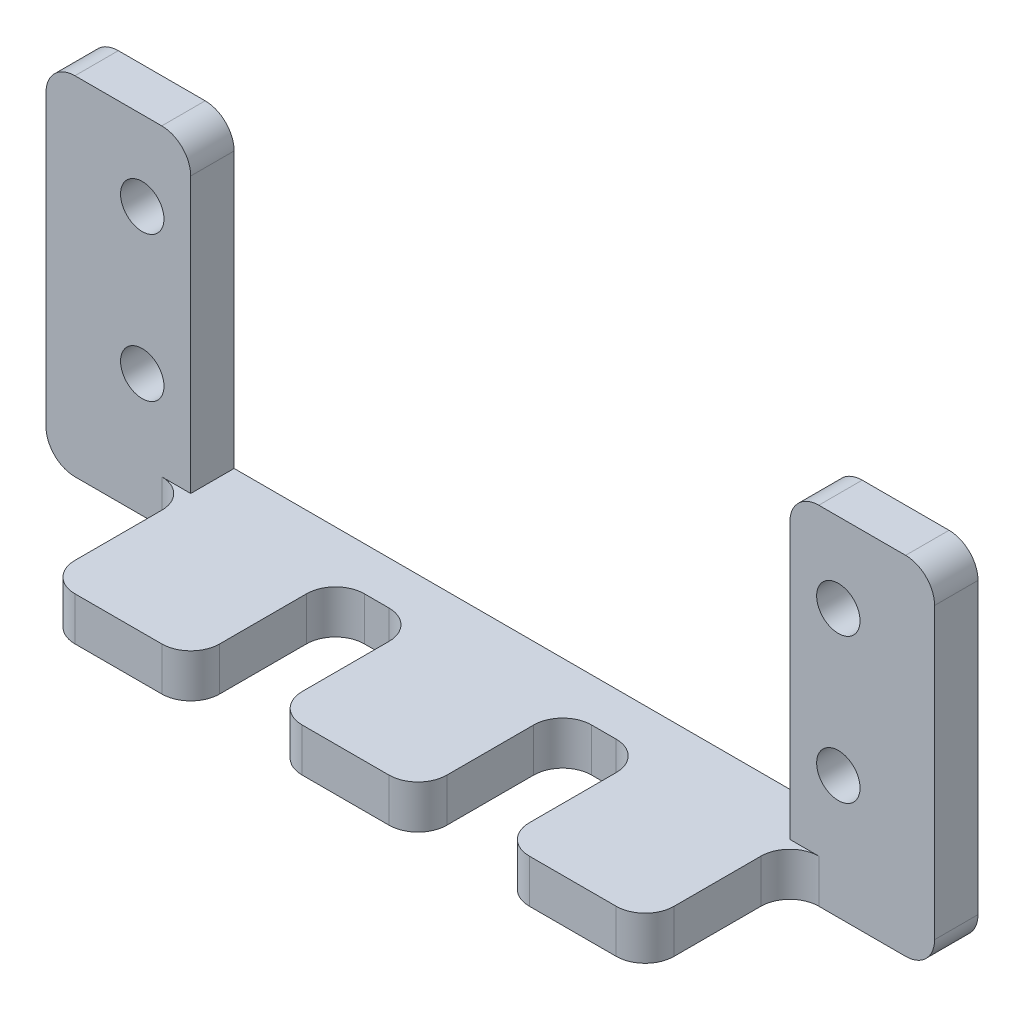
from build123d import *

# Parameters (mm, degrees)
SKETCH1_R           = 1.5
BOSS_EXTRUDE1_DEPTH = 3
SKETCH2_W           = 10
SKETCH2_H           = 3
BOSS_EXTRUDE2_DEPTH = 10
FILLET1_R           = 2


with BuildPart() as part:
    # Sketch1 → Boss-Extrude1 (new body)
    with BuildSketch(Plane.XY):
        Polygon((10, 24), (10, 3), (51.4, 3), (51.4, 24), (61.4, 24), (61.4, 0), (0, 0), (0, 24), align=None)
        with Locations((6.65, 8.5)):
            Circle(SKETCH1_R, mode=Mode.SUBTRACT)
        with Locations((6.65, 18.5)):
            Circle(SKETCH1_R, mode=Mode.SUBTRACT)
        with Locations((54.75, 18.5)):
            Circle(SKETCH1_R, mode=Mode.SUBTRACT)
        with Locations((54.75, 8.5)):
            Circle(SKETCH1_R, mode=Mode.SUBTRACT)
    extrude(amount=BOSS_EXTRUDE1_DEPTH)

    # Sketch2 → Boss-Extrude2 (add)
    with BuildSketch(Plane.XY.offset(3)):
        with Locations((15, 1.5)):
            Rectangle(SKETCH2_W, SKETCH2_H)
        with Locations((46.4, 1.5)):
            Rectangle(SKETCH2_W, SKETCH2_H)
        with Locations((30.7, 1.5)):
            Rectangle(SKETCH2_W, SKETCH2_H)
    extrude(amount=BOSS_EXTRUDE2_DEPTH)

    # Fillet1
    fillet1_edges = [part.edges().sort_by_distance(p)[0] for p in [
        (10, 1.5, 3),
        (51.4, 1.5, 3),
        (20, 1.5, 3),
        (10, 1.5, 13),
        (20, 1.5, 13),
        (25.7, 1.5, 3),
        (41.4, 1.5, 3),
        (35.7, 1.5, 3),
        (25.7, 1.5, 13),
        (35.7, 1.5, 13),
        (41.4, 1.5, 13),
        (51.4, 1.5, 13),
        (51.4, 24, 1.5),
        (61.4, 24, 1.5),
        (61.4, 0, 1.5),
        (0, 0, 1.5),
        (0, 24, 1.5),
        (10, 24, 1.5),
    ]]
    fillet(fillet1_edges, radius=FILLET1_R)


solid = part.part
